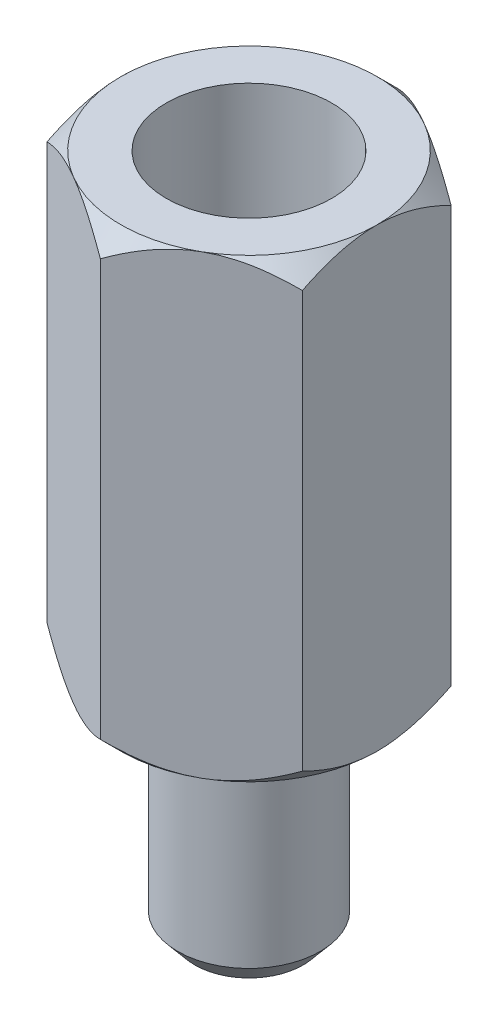
from build123d import *

# Parameters (mm, degrees)
SKETCH1_R           = 1.25
BOSS_EXTRUDE1_DEPTH = 3.9
BOSS_EXTRUDE2_DEPTH = 8
SKETCH3_R           = 1.45181539
CUT_EXTRUDE1_DEPTH  = 4.8
SKETCH4_OUTSIDE_W   = 36.034
SKETCH4_OUTSIDE_H   = 36.72
SKETCH4_OUTSIDE_R   = 2.25
CUT_EXTRUDE2_DEPTH  = 13.387300307
CUT_EXTRUDE2_DRAFT  = -45
SKETCH5_OUTSIDE_W   = 28.676
SKETCH5_OUTSIDE_H   = 29.362
SKETCH5_OUTSIDE_R   = 2.25
CUT_EXTRUDE3_DEPTH  = 9.708341341
CUT_EXTRUDE3_DRAFT  = -45
CHAMFER1_SIZE       = 0.3
CHAMFER1_SIZE2      = 0.357526078


with BuildPart() as part:
    # Sketch1 → Boss-Extrude1 (new body)
    with BuildSketch(Plane(origin=(0, 0, 0), x_dir=(1, 0, 0), z_dir=(0, 1, 0))):
        with Locations(Location((0, 0, 0), (0, 0, 270))):
            Circle(SKETCH1_R)
    extrude(amount=BOSS_EXTRUDE1_DEPTH)

    # Sketch2 → Boss-Extrude2 (add)
    with BuildSketch(Plane(origin=(0, 3.9, 0), x_dir=(1, 0, 0), z_dir=(0, 1, 0))):
        Polygon((2.244901907, -1.307828516), (2.255063672, 1.290227823), (0.010161765, 2.598056339), (-2.244901907, 1.307828516), (-2.255063672, -1.290227823), (-0.010161765, -2.598056339), align=None)
    extrude(amount=BOSS_EXTRUDE2_DEPTH)

    # Sketch3 → Cut-Extrude1 (cut)
    with BuildSketch(Plane(origin=(0, 11.9, 0), x_dir=(1, 0, 0), z_dir=(0, 1, 0))):
        with Locations(Location((0, 0, 0), (0, 0, 270))):
            Circle(SKETCH3_R)
    extrude(amount=-CUT_EXTRUDE1_DEPTH, mode=Mode.SUBTRACT)


with BuildPart() as cut_extrude2_tool:
    # Sketch4 outside → Cut-Extrude2 (with draft: the straight prism first)
    with BuildSketch(Plane(origin=(0, 11.9, 0), x_dir=(1, 0, 0), z_dir=(0, 1, 0))):
        Rectangle(SKETCH4_OUTSIDE_W, SKETCH4_OUTSIDE_H)
        Circle(SKETCH4_OUTSIDE_R, mode=Mode.SUBTRACT)
    extrude(amount=-CUT_EXTRUDE2_DEPTH)
    # Cut-Extrude2: the draft: its side faces are tilted about the plane it starts from
    cut_extrude2_sides = [cut_extrude2_tool.faces().sort_by_distance(p)[0] for p in [
        (0, 5.206349846, 18.36),
        (18.017, 5.206349846, 0),
        (0, 5.206349846, -18.36),
        (-18.017, 5.206349846, 0),
        (-2.25, 5.206349846, 0),
    ]]
    draft(cut_extrude2_sides, Plane(origin=(0, 11.9, 0), x_dir=(1, 0, 0), z_dir=(0, 1, 0)), CUT_EXTRUDE2_DRAFT)


with BuildPart() as part_1:
    add(part.part)

    # Cut-Extrude2: cut by cut_extrude2_tool
    add(cut_extrude2_tool.part, mode=Mode.SUBTRACT)


with BuildPart() as cut_extrude3_tool:
    # Sketch5 outside → Cut-Extrude3 (with draft: the straight prism first)
    with BuildSketch(Plane.XZ.offset(-3.9)):
        Rectangle(SKETCH5_OUTSIDE_W, SKETCH5_OUTSIDE_H)
        Circle(SKETCH5_OUTSIDE_R, mode=Mode.SUBTRACT)
    extrude(amount=-CUT_EXTRUDE3_DEPTH)
    # Cut-Extrude3: the draft: its side faces are tilted about the plane it starts from
    cut_extrude3_sides = [cut_extrude3_tool.faces().sort_by_distance(p)[0] for p in [
        (0, 8.75417067, -14.681),
        (14.338, 8.75417067, 0),
        (0, 8.75417067, 14.681),
        (-14.338, 8.75417067, 0),
        (-2.25, 8.75417067, 0),
    ]]
    draft(cut_extrude3_sides, Plane.XZ.offset(-3.9), CUT_EXTRUDE3_DRAFT)


with BuildPart() as part_2:
    add(part_1.part)

    # Cut-Extrude3: cut by cut_extrude3_tool
    add(cut_extrude3_tool.part, mode=Mode.SUBTRACT)

    # Chamfer1
    chamfer1_edges = [part_2.edges().sort_by_distance(p)[0] for p in [
        (0, 0, -1.25),
    ]]
    chamfer1_side = [part_2.faces().sort_by_distance(p)[0] for p in [
        (0, 0, 0),
    ]]
    chamfer(chamfer1_edges, length=CHAMFER1_SIZE, length2=CHAMFER1_SIZE2, reference=chamfer1_side[0])


solid = part_2.part
